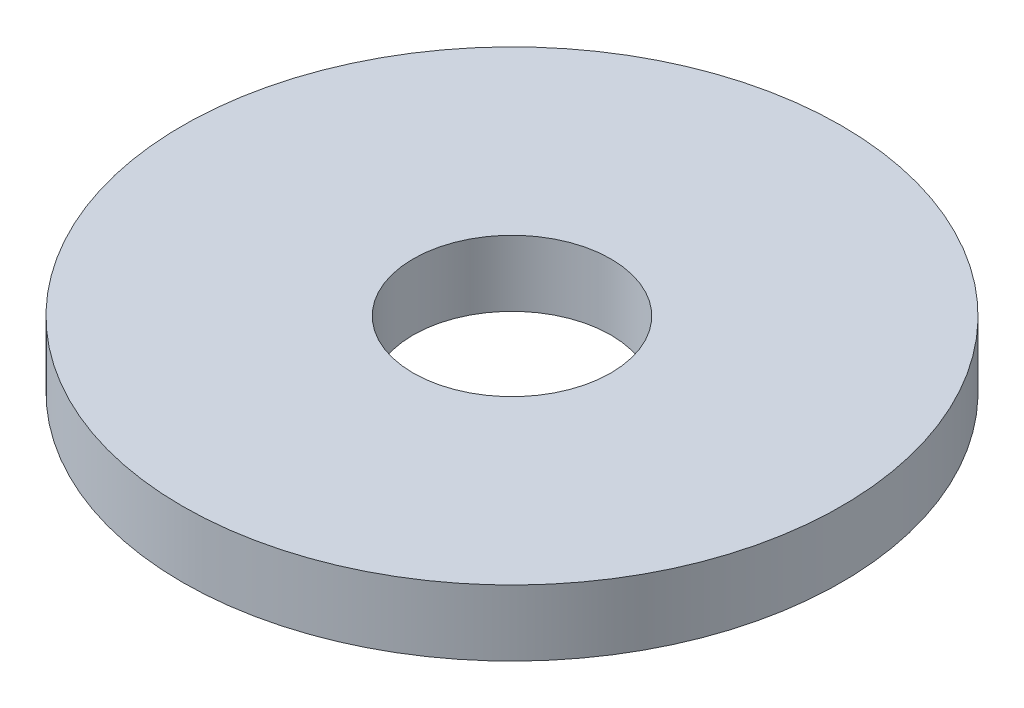
from build123d import *

# Parameters (mm, degrees)
SKETCH2_R           = 5
BOSS_EXTRUDE1_DEPTH = 1
SKETCH3_R           = 1.5
CUT_EXTRUDE1_DEPTH  = 1


with BuildPart() as part:
    # Sketch2 → Boss-Extrude1 (new body)
    with BuildSketch(Plane(origin=(0, 0, 0), x_dir=(1, 0, 0), z_dir=(0, 1, 0))):
        with Locations(Location((0, 0, 0), (0, 0, 270))):
            Circle(SKETCH2_R)
    extrude(amount=BOSS_EXTRUDE1_DEPTH)

    # Sketch3 → Cut-Extrude1 (cut)
    with BuildSketch(Plane(origin=(0, 1, 0), x_dir=(1, 0, 0), z_dir=(0, 1, 0))):
        with Locations(Location((0, 0, 0), (0, 0, 270))):
            Circle(SKETCH3_R)
    extrude(amount=-CUT_EXTRUDE1_DEPTH, mode=Mode.SUBTRACT)


solid = part.part
